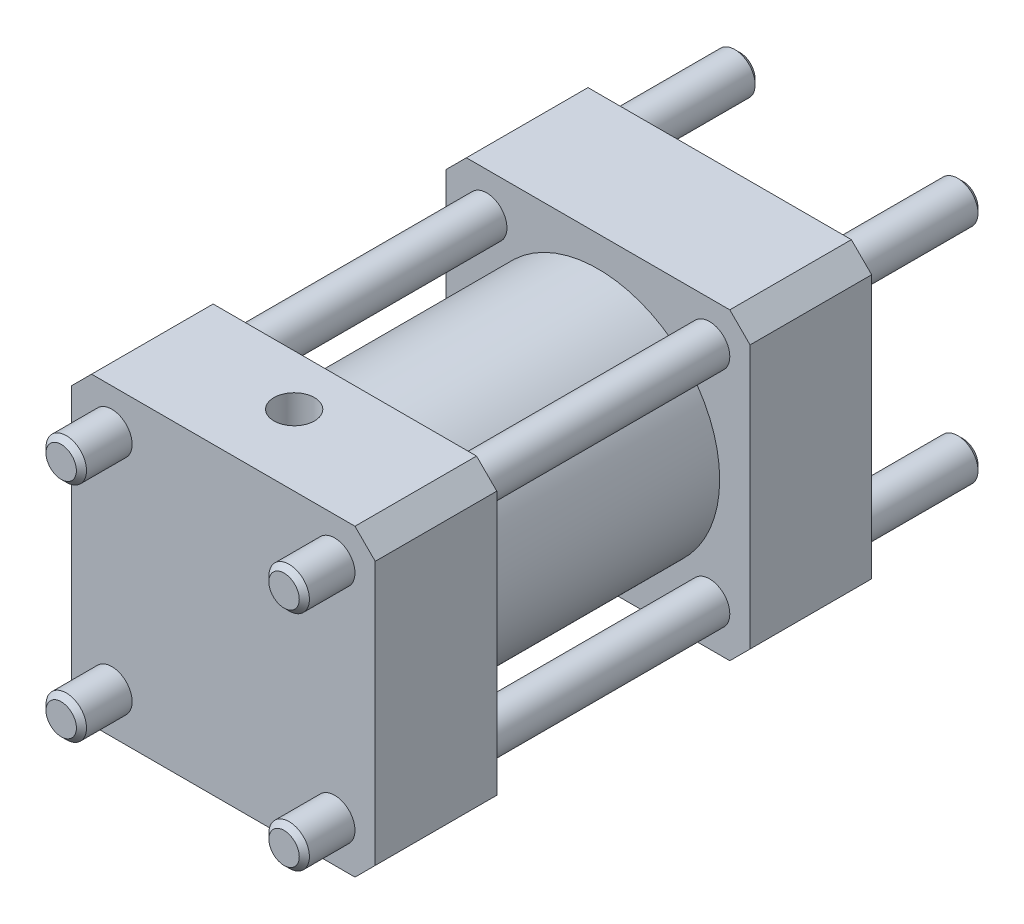
from build123d import *

# Parameters (mm, degrees)
ESQUISSE1_W                       = 30
ESQUISSE1_H                       = 30
BASE_EXTRUSION_DEPTH              = 12
ESQUISSE2_R                       = 12
ESQUISSE2_R_2                     = 10
BOS_EXTRU_MINCE1_DEPTH            = 25
ESQUISSE3_W                       = 30
ESQUISSE3_H                       = 30
BOSS_EXTRU_1_DEPTH                = 12
BOSS_EXTRU_2_REACH                = 58.294
ESQUISSE4_R                       = 2
BOSS_EXTRU_3_REACH                = 53.124
ESQUISSE5_R                       = 2
BOSS_EXTRU_4_REACH                = 64.884
ESQUISSE6_R                       = 2
BOSS_EXTRU_5_REACH                = 69.61
ESQUISSE7_R                       = 2
ESQUISSE10_R                      = 9
BOSS_EXTRU_6_DEPTH                = 6
EXTRUSION1_START                  = 13
ESQUISSE15_R                      = 2
EXTRUSION1_DEPTH                  = 13
ESQUISSE16_R                      = 2
EXTRUSION2_DEPTH                  = 5
CHANFREIN2_SIZE                   = 0.5
CHANFREIN5_SIZE                   = 1
ESQUISSE17_R                      = 4
ENL_V_MAT_EXTRU_1_DEPTH           = 26.67049611
CHANFREIN6_SIZE                   = 2
ESQUISSE24_R                      = 7.5
ESQUISSE24_R_2                    = 6.5
ENL_V_MAT_EXTRU_2_DEPTH           = 8
ESQUISSE25_R                      = 6.5
ENL_V_MAT_EXTRU_3_DEPTH           = 4
CHANFREIN7_SIZE                   = 1
DIAM_TRE_DU_PER_AGE_4_0_4_1_D     = 4
DIAM_TRE_DU_PER_AGE_4_0_4_1_DEPTH = 17
DIAM_TRE_DU_PER_AGE_4_0_4_1_TIP   = 1.201721238
ESQUISSE28_R                      = 2
ENL_V_MAT_EXTRU_4_DEPTH           = 5


with BuildPart() as part:
    # Esquisse1 → Base-Extrusion (new body)
    with BuildSketch(Plane.XY):
        with Locations((15, 15)):
            Rectangle(ESQUISSE1_W, ESQUISSE1_H)
    extrude(amount=BASE_EXTRUSION_DEPTH)

    # Esquisse2 → Bos.-Extru.-Mince1 (add)
    with BuildSketch(Plane.XY.offset(12)):
        with Locations((15, 15)):
            Circle(ESQUISSE2_R)
        with Locations((15, 15)):
            Circle(ESQUISSE2_R_2, mode=Mode.SUBTRACT)
    extrude(amount=BOS_EXTRU_MINCE1_DEPTH)

    # Esquisse3 → Boss.-Extru.1 (add)
    with BuildSketch(Plane.XY.offset(37)):
        with Locations((15, 15)):
            Rectangle(ESQUISSE3_W, ESQUISSE3_H)
    extrude(amount=BOSS_EXTRU_1_DEPTH)

    # Esquisse4 → Boss.-Extru.2 (add, up to next)
    with BuildSketch(Plane.XY.offset(12), mode=Mode.PRIVATE) as boss_extru_2_sk1:
        with Locations(Location((4, 26, 0), (0, 0, 180))):
            Circle(ESQUISSE4_R)
    boss_extru_2_tool1 = extrude(boss_extru_2_sk1.sketch, amount=BOSS_EXTRU_2_REACH, mode=Mode.PRIVATE) - part.part
    add(boss_extru_2_tool1.solids().sort_by_distance((4, 26, 12))[0])

    # Esquisse5 → Boss.-Extru.3 (add, up to next)
    with BuildSketch(Plane(origin=(19.916830052, 0.880144556, 12), x_dir=(1, 0, 0), z_dir=(0, 0, 1)), mode=Mode.PRIVATE) as boss_extru_3_sk1:
        with Locations(Location((6.083169948, 25.119855444, 0), (0, 0, 180))):
            Circle(ESQUISSE5_R)
    boss_extru_3_tool1 = extrude(boss_extru_3_sk1.sketch, amount=BOSS_EXTRU_3_REACH, mode=Mode.PRIVATE) - part.part
    add(boss_extru_3_tool1.solids().sort_by_distance((26, 26, 12))[0])

    # Esquisse6 → Boss.-Extru.4 (add, up to next)
    with BuildSketch(Plane(origin=(19.426828301, -16.989020523, 12), x_dir=(1, 0, 0), z_dir=(0, 0, 1)), mode=Mode.PRIVATE) as boss_extru_4_sk1:
        with Locations(Location((6.573171699, 20.989020523, 0), (0, 0, 180))):
            Circle(ESQUISSE6_R)
    boss_extru_4_tool1 = extrude(boss_extru_4_sk1.sketch, amount=BOSS_EXTRU_4_REACH, mode=Mode.PRIVATE) - part.part
    add(boss_extru_4_tool1.solids().sort_by_distance((26, 4, 12))[0])

    # Esquisse7 → Boss.-Extru.5 (add, up to next)
    with BuildSketch(Plane(origin=(0.731824689, -18.430102912, 12), x_dir=(1, 0, 0), z_dir=(0, 0, 1)), mode=Mode.PRIVATE) as boss_extru_5_sk1:
        with Locations(Location((3.268175311, 22.430102912, 0), (0, 0, 180))):
            Circle(ESQUISSE7_R)
    boss_extru_5_tool1 = extrude(boss_extru_5_sk1.sketch, amount=BOSS_EXTRU_5_REACH, mode=Mode.PRIVATE) - part.part
    add(boss_extru_5_tool1.solids().sort_by_distance((4, 4, 12))[0])

    # Esquisse10 → Boss.-Extru.6 (add)
    with BuildSketch(Plane(origin=(0, 0, 0), x_dir=(-1, 0, 0), z_dir=(0, 0, -1))):
        with Locations(Location((-15, 15, 0), (0, 0, 180))):
            Circle(ESQUISSE10_R)
    extrude(amount=BOSS_EXTRU_6_DEPTH)

    # Esquisse15 → Extrusion1 (add)
    with BuildSketch(Plane(origin=(0, 0, 0), x_dir=(-1, 0, 0), z_dir=(0, 0, -1)).offset(EXTRUSION1_START)):
        with Locations((-4, 26)):
            Circle(ESQUISSE15_R)
        with Locations((-4, 4)):
            Circle(ESQUISSE15_R)
        with Locations((-26, 4)):
            Circle(ESQUISSE15_R)
        with Locations((-26, 26)):
            Circle(ESQUISSE15_R)
    extrude(amount=-EXTRUSION1_DEPTH)

    # Esquisse16 → Extrusion2 (add)
    with BuildSketch(Plane.XY.offset(49)):
        with Locations(Location((26, 26, 0), (0, 0, 180))):
            Circle(ESQUISSE16_R)
        with Locations(Location((26, 4, 0), (0, 0, 180))):
            Circle(ESQUISSE16_R)
        with Locations(Location((4, 4, 0), (0, 0, 180))):
            Circle(ESQUISSE16_R)
        with Locations(Location((4, 26, 0), (0, 0, 180))):
            Circle(ESQUISSE16_R)
    extrude(amount=EXTRUSION2_DEPTH)

    # Chanfrein2
    chanfrein2_edges = [part.edges().sort_by_distance(p)[0] for p in [
        (6, 26, -13),
        (6, 4, -13),
        (28, 4, -13),
        (28, 26, -13),
        (28, 26, 54),
        (28, 4, 54),
        (6, 4, 54),
        (6, 26, 54),
    ]]
    chamfer(chanfrein2_edges, length=CHANFREIN2_SIZE)

    # Chanfrein5
    chanfrein5_edges = [part.edges().sort_by_distance(p)[0] for p in [
        (6, 15, -6),
    ]]
    chamfer(chanfrein5_edges, length=CHANFREIN5_SIZE)

    # Esquisse17 → Enlèv. mat.-Extru.1 (cut)
    with BuildSketch(Plane(origin=(0, 0, -6), x_dir=(-1, 0, 0), z_dir=(0, 0, -1))):
        with Locations((-15, 15)):
            Circle(ESQUISSE17_R)
    extrude(amount=-ENL_V_MAT_EXTRU_1_DEPTH, mode=Mode.SUBTRACT)

    # Chanfrein6
    chanfrein6_edges = [part.edges().sort_by_distance(p)[0] for p in [
        (0, 30, 43),
        (0, 0, 43),
        (30, 0, 43),
        (30, 30, 43),
        (0, 30, 6),
        (30, 30, 6),
        (30, 0, 6),
        (0, 0, 6),
    ]]
    chamfer(chanfrein6_edges, length=CHANFREIN6_SIZE)

    # Esquisse24 → Enlèv. mat.-Extru.2 (cut)
    with BuildSketch(Plane.XY.offset(12)):
        with Locations((15, 15)):
            Circle(ESQUISSE24_R)
        with Locations((15, 15)):
            Circle(ESQUISSE24_R_2, mode=Mode.SUBTRACT)
    extrude(amount=-ENL_V_MAT_EXTRU_2_DEPTH, mode=Mode.SUBTRACT)

    # Esquisse25 → Enlèv. mat.-Extru.3 (cut)
    with BuildSketch(Plane.XY.offset(12)):
        with Locations((15, 15)):
            Circle(ESQUISSE25_R)
    extrude(amount=-ENL_V_MAT_EXTRU_3_DEPTH, mode=Mode.SUBTRACT)

    # Chanfrein7
    chanfrein7_edges = [part.edges().sort_by_distance(p)[0] for p in [
        (8.5, 15, 8),
    ]]
    chamfer(chanfrein7_edges, length=CHANFREIN7_SIZE)

    # Diamètre du perçage Ø4.0 (4)1
    with Locations(Plane(origin=(0, 30, 0), x_dir=(-1, 0, 0), z_dir=(0, 1, 0))):
        with Locations((-15, 42)):
            Hole(DIAM_TRE_DU_PER_AGE_4_0_4_1_D / 2, depth=DIAM_TRE_DU_PER_AGE_4_0_4_1_DEPTH)
            with Locations((0, 0, -(DIAM_TRE_DU_PER_AGE_4_0_4_1_DEPTH + DIAM_TRE_DU_PER_AGE_4_0_4_1_TIP / 2))):  # 118° drill point
                Cone(0, DIAM_TRE_DU_PER_AGE_4_0_4_1_D / 2, DIAM_TRE_DU_PER_AGE_4_0_4_1_TIP, mode=Mode.SUBTRACT)

    # Esquisse28 → Enlèv. mat.-Extru.4 (cut)
    with BuildSketch(Plane(origin=(0, 0, 37), x_dir=(-1, 0, 0), z_dir=(0, 0, -1))):
        with Locations((-15, 15)):
            Circle(ESQUISSE28_R)
    extrude(amount=-ENL_V_MAT_EXTRU_4_DEPTH, mode=Mode.SUBTRACT)


solid = part.part
